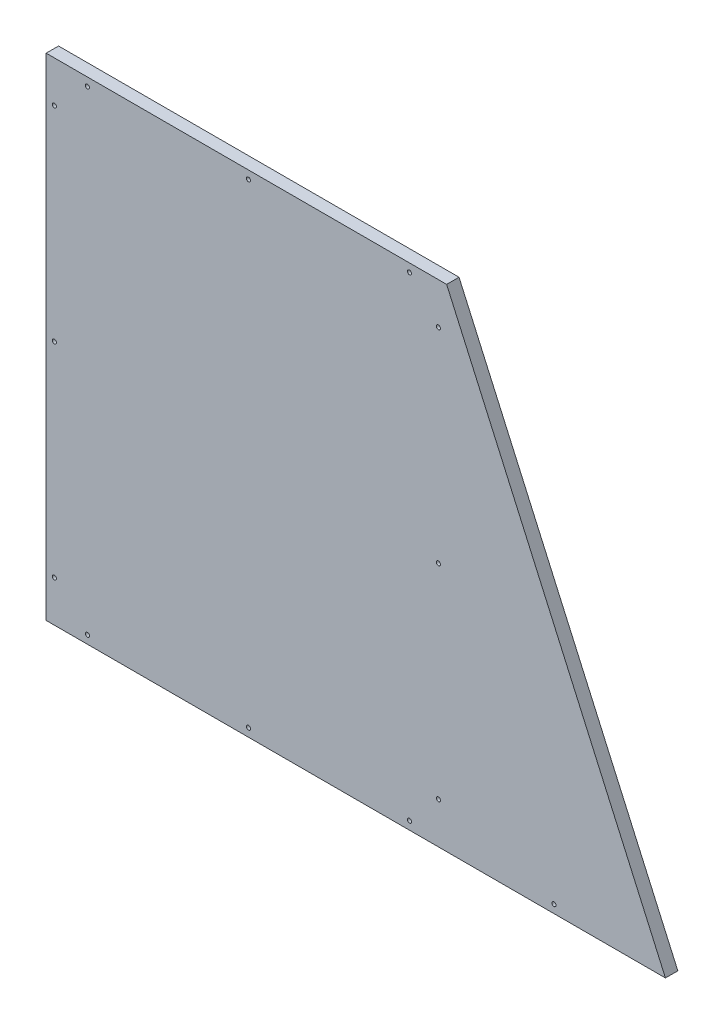
from build123d import *

# Parameters (mm, degrees)
EXTRUDE_1_DEPTH     = 15
SKETCH_2_R          = 2.5
CUT_EXTRUDE_1_DEPTH = 589.461978381
SKETCH_2_3_R        = 2.5
CUT_EXTRUDE_2_DEPTH = 589.461978381
SKETCH_4_R          = 2.5
CUT_EXTRUDE_3_DEPTH = 589.461978381


with BuildPart() as part:
    # ｽｹｯﾁ1 → ﾎﾞｽ - 押し出し1 (new body)
    with BuildSketch(Plane.XY):
        Polygon((-242.5, 297.5), (242.5, 297.5), (507.5, -297.5), (-242.5, -297.5), align=None)
    extrude(amount=EXTRUDE_1_DEPTH)

    # ｽｹｯﾁ2 → ｶｯﾄ - 押し出し1 (cut, through all)
    with BuildSketch(Plane.XY.offset(15)):
        with Locations((-192.5, 287.5)):
            Circle(SKETCH_2_R)
        with Locations((2.5, 287.5)):
            Circle(SKETCH_2_R)
        with Locations((197.5, 287.5)):
            Circle(SKETCH_2_R)
    cut_extrude_1 = extrude(amount=-CUT_EXTRUDE_1_DEPTH, mode=Mode.SUBTRACT)

    # ｽｹｯﾁ2<3> → ｶｯﾄ - 押し出し2 (cut, through all)
    with BuildSketch(Plane.XY.offset(15)):
        with Locations((-232.5, 247.5)):
            Circle(SKETCH_2_3_R)
        with Locations((-232.5, 0)):
            Circle(SKETCH_2_3_R)
        with Locations((-232.5, -247.5)):
            Circle(SKETCH_2_3_R)
    cut_extrude_2 = extrude(amount=-CUT_EXTRUDE_2_DEPTH, mode=Mode.SUBTRACT)

    # ﾐﾗｰ1: ｶｯﾄ - 押し出し1 across plane
    add(cut_extrude_1.mirror(Plane.ZX), mode=Mode.SUBTRACT)

    # ﾐﾗｰ2: ｶｯﾄ - 押し出し2 across plane
    add(cut_extrude_2.mirror(Plane(origin=(0, 0, 0), x_dir=(0, 0, 1), z_dir=(1, 0, 0))), mode=Mode.SUBTRACT)

    # ｽｹｯﾁ4 → ｶｯﾄ - 押し出し3 (cut, through all)
    with BuildSketch(Plane.XY.offset(15)):
        with Locations((372.5, -287.5)):
            Circle(SKETCH_4_R)
    extrude(amount=-CUT_EXTRUDE_3_DEPTH, mode=Mode.SUBTRACT)


solid = part.part
